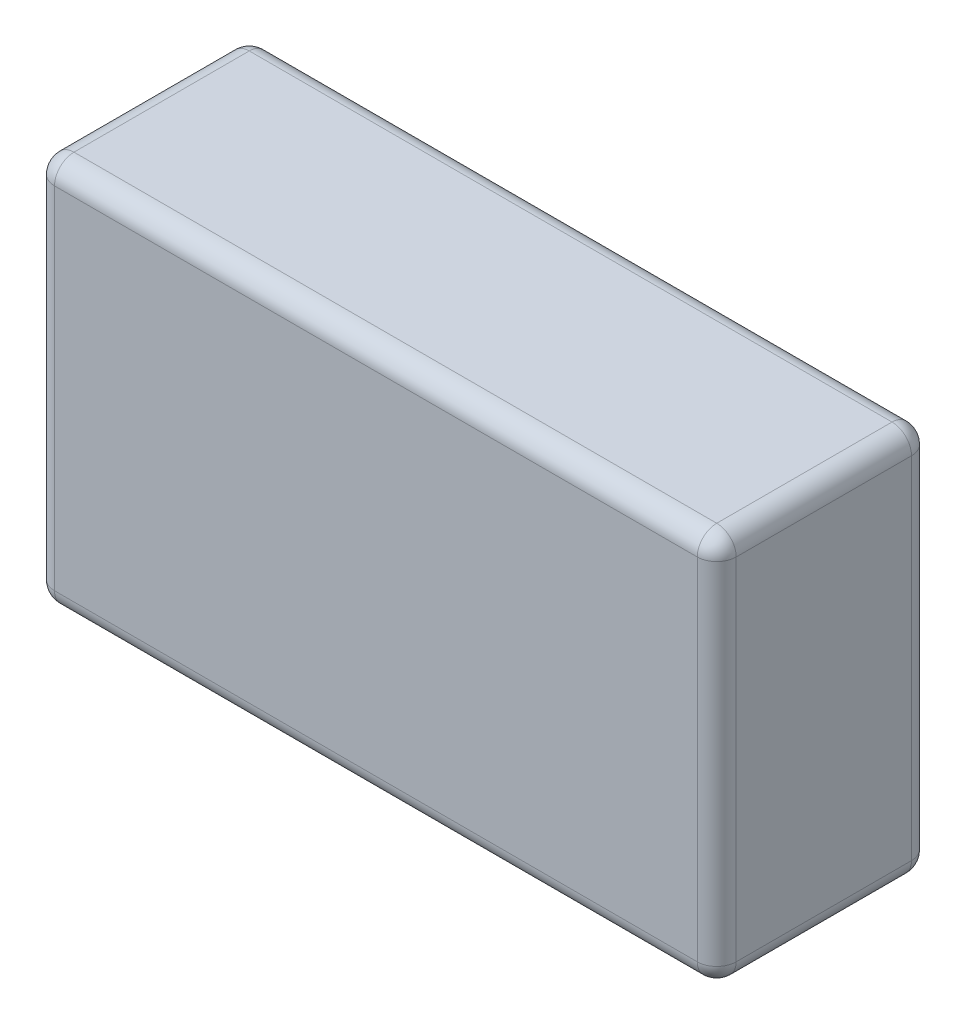
from build123d import *

# Parameters (mm, degrees)
SKETCH_1_W      = 70
SKETCH_1_H      = 40
EXTRUDE_1_DEPTH = 11
FILLET_1_R      = 2


with BuildPart() as part:
    # 草图1 → 凸台-拉伸1 (new, symmetric)
    with BuildSketch(Plane.XY):
        Rectangle(SKETCH_1_W, SKETCH_1_H)
    extrude(amount=EXTRUDE_1_DEPTH, both=True)

    # 圆角1
    fillet_1_edges = [part.edges().sort_by_distance(p)[0] for p in [
        (-35, 0, 11),
        (0, -20, 11),
        (35, 0, 11),
        (0, -20, -11),
        (-35, 0, -11),
        (0, 20, -11),
        (35, 0, -11),
        (35, -20, 0),
        (-35, -20, 0),
        (-35, 20, 0),
        (35, 20, 0),
        (0, 20, 11),
    ]]
    fillet(fillet_1_edges, radius=FILLET_1_R)


solid = part.part
